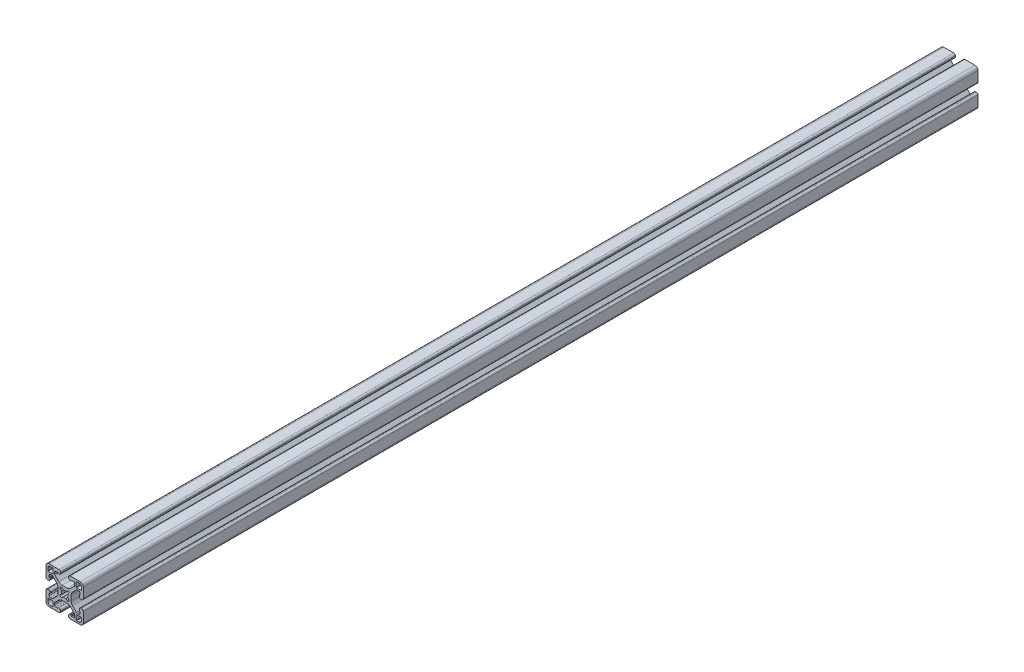
from build123d import *

# Parameters (mm, degrees)
EXTRUDE1_DEPTH = 914.4


with BuildPart() as part:
    # Sketch1 → Extrude1 (new body)
    with BuildSketch(Plane.XY):
        with BuildLine():
            Line((-46.536752228, -7.000622168), (-46.536752228, -8.774580164))
            ThreePointArc((-46.536752228, -8.774580164), (-46.907290083, -9.675221514), (-47.806745776, -10.048628264))
            Line((-47.806745776, -10.048628264), (-49.392633083, -10.048628264))
            ThreePointArc((-49.392633083, -10.048628264), (-49.878641042, -9.95195527), (-50.290658695, -9.676653876))
            Line((-50.290658695, -9.676653876), (-54.238761565, -5.728551005))
            ThreePointArc((-54.238761565, -5.728551005), (-55.26838878, -4.187604983), (-55.629945776, -2.369935216))
            Line((-55.629945776, -2.369935216), (-55.629945776, 2.846678689))
            ThreePointArc((-55.629945776, 2.846678689), (-55.26838878, 4.664348456), (-54.238761565, 6.205294478))
            Line((-54.238761565, 6.205294478), (-50.290658695, 10.153397348))
            ThreePointArc((-50.290658695, 10.153397348), (-49.878641042, 10.428698742), (-49.392633083, 10.525371736))
            Line((-49.392633083, 10.525371736), (-47.806745776, 10.525371736))
            ThreePointArc((-47.806745776, 10.525371736), (-46.907290079, 10.151964982), (-46.536752228, 9.251323623))
            Line((-46.536752228, 9.251323623), (-46.536752228, 7.47736564))
            ThreePointArc((-46.536752228, 7.47736564), (-46.648344767, 7.207957418), (-46.91775299, 7.096364878))
            Line((-46.91775299, 7.096364878), (-46.993953142, 7.096364878))
            ThreePointArc((-46.993953142, 7.096364878), (-47.263362671, 6.984771032), (-47.374953904, 6.715360422))
            Line((-47.374953904, 6.715360422), (-47.374945776, 5.877156465))
            ThreePointArc((-47.374945776, 5.877156465), (-46.913692136, 4.763614578), (-45.800145776, 4.302371736))
            Line((-45.800145776, 4.302371736), (-44.885745776, 4.302371736))
            ThreePointArc((-44.885745776, 4.302371736), (-43.772194017, 4.763619977), (-43.310945776, 5.877171736))
            Line((-43.310945776, 5.877171736), (-43.310945776, 16.113371736))
            ThreePointArc((-43.310945776, 16.113371736), (-44.240881746, 18.358435766), (-46.485945776, 19.288371736))
            Line((-46.485945776, 19.288371736), (-56.722145776, 19.288371736))
            ThreePointArc((-56.722145776, 19.288371736), (-57.835697535, 18.827123495), (-58.296945776, 17.713571736))
            Line((-58.296945776, 17.713571736), (-58.296945776, 16.799171736))
            ThreePointArc((-58.296945776, 16.799171736), (-57.835702934, 15.685625376), (-56.722161047, 15.224371736))
            Line((-56.722161047, 15.224371736), (-55.883957091, 15.224363608))
            ThreePointArc((-55.883957091, 15.224363608), (-55.61454648, 15.335954841), (-55.502952634, 15.60536437))
            Line((-55.502952634, 15.60536437), (-55.502952634, 15.681564523))
            ThreePointArc((-55.502952634, 15.681564523), (-55.391360095, 15.950972745), (-55.121951872, 16.062565285))
            Line((-55.121951872, 16.062565285), (-53.347993876, 16.062565285))
            ThreePointArc((-53.347993876, 16.062565285), (-52.447352526, 15.692027429), (-52.073945776, 14.792571736))
            Line((-52.073945776, 14.792571736), (-52.073945776, 13.206684429))
            ThreePointArc((-52.073945776, 13.206684429), (-52.17061877, 12.72067647), (-52.445920164, 12.308658817))
            Line((-52.445920164, 12.308658817), (-56.394023034, 8.360555947))
            ThreePointArc((-56.394023034, 8.360555947), (-57.934969057, 7.330928733), (-59.752638824, 6.969371736))
            Line((-59.752638824, 6.969371736), (-64.969252728, 6.969371736))
            ThreePointArc((-64.969252728, 6.969371736), (-66.786922495, 7.330928733), (-68.327868518, 8.360555947))
            Line((-68.327868518, 8.360555947), (-72.275971388, 12.308658817))
            ThreePointArc((-72.275971388, 12.308658817), (-72.551272782, 12.72067647), (-72.647945776, 13.206684429))
            Line((-72.647945776, 13.206684429), (-72.647945776, 14.792571736))
            ThreePointArc((-72.647945776, 14.792571736), (-72.274539022, 15.692027434), (-71.373897663, 16.062565285))
            Line((-71.373897663, 16.062565285), (-69.59993968, 16.062565285))
            ThreePointArc((-69.59993968, 16.062565285), (-69.330531458, 15.950972745), (-69.218938918, 15.681564523))
            Line((-69.218938918, 15.681564523), (-69.218938918, 15.60536437))
            ThreePointArc((-69.218938918, 15.60536437), (-69.107345072, 15.335954841), (-68.837934461, 15.224363608))
            Line((-68.837934461, 15.224363608), (-67.999730505, 15.224371736))
            ThreePointArc((-67.999730505, 15.224371736), (-66.886188618, 15.685625376), (-66.424945776, 16.799171736))
            Line((-66.424945776, 16.799171736), (-66.424945776, 17.713571736))
            ThreePointArc((-66.424945776, 17.713571736), (-66.886194017, 18.827123495), (-67.999745776, 19.288371736))
            Line((-67.999745776, 19.288371736), (-78.235945776, 19.288371736))
            ThreePointArc((-78.235945776, 19.288371736), (-80.481009806, 18.358435766), (-81.410945776, 16.113371736))
            Line((-81.410945776, 16.113371736), (-81.410945776, 5.877171736))
            ThreePointArc((-81.410945776, 5.877171736), (-80.949697535, 4.763619977), (-79.836145776, 4.302371736))
            Line((-79.836145776, 4.302371736), (-78.921745776, 4.302371736))
            ThreePointArc((-78.921745776, 4.302371736), (-77.808199416, 4.763614578), (-77.346945776, 5.877156465))
            Line((-77.346945776, 5.877156465), (-77.346937648, 6.715360422))
            ThreePointArc((-77.346937648, 6.715360422), (-77.458528881, 6.984771032), (-77.72793841, 7.096364878))
            Line((-77.72793841, 7.096364878), (-77.804138562, 7.096364878))
            ThreePointArc((-77.804138562, 7.096364878), (-78.073546785, 7.207957418), (-78.185139324, 7.47736564))
            Line((-78.185139324, 7.47736564), (-78.185139324, 9.251323637))
            ThreePointArc((-78.185139324, 9.251323637), (-77.814601469, 10.151964987), (-76.915145776, 10.525371736))
            Line((-76.915145776, 10.525371736), (-75.329258469, 10.525371736))
            ThreePointArc((-75.329258469, 10.525371736), (-74.84325051, 10.428698742), (-74.431232857, 10.153397348))
            Line((-74.431232857, 10.153397348), (-70.483129987, 6.205294478))
            ThreePointArc((-70.483129987, 6.205294478), (-69.453502773, 4.664348456), (-69.091945776, 2.846678689))
            Line((-69.091945776, 2.846678689), (-69.091945776, -2.369935216))
            ThreePointArc((-69.091945776, -2.369935216), (-69.453502773, -4.187604983), (-70.483129987, -5.728551005))
            Line((-70.483129987, -5.728551005), (-74.431232857, -9.676653876))
            ThreePointArc((-74.431232857, -9.676653876), (-74.84325051, -9.95195527), (-75.329258469, -10.048628264))
            Line((-75.329258469, -10.048628264), (-76.915145776, -10.048628264))
            ThreePointArc((-76.915145776, -10.048628264), (-77.814601473, -9.67522151), (-78.185139324, -8.774580151))
            Line((-78.185139324, -8.774580151), (-78.185139324, -7.000622168))
            ThreePointArc((-78.185139324, -7.000622168), (-78.073546785, -6.731213945), (-77.804138562, -6.619621406))
            Line((-77.804138562, -6.619621406), (-77.72793841, -6.619621406))
            ThreePointArc((-77.72793841, -6.619621406), (-77.458528881, -6.50802756), (-77.346937648, -6.238616949))
            Line((-77.346937648, -6.238616949), (-77.346945776, -5.400412993))
            ThreePointArc((-77.346945776, -5.400412993), (-77.808199416, -4.286871106), (-78.921745776, -3.825628264))
            Line((-78.921745776, -3.825628264), (-79.836145776, -3.825628264))
            ThreePointArc((-79.836145776, -3.825628264), (-80.949697535, -4.286876505), (-81.410945776, -5.400428264))
            Line((-81.410945776, -5.400428264), (-81.410945776, -15.636628264))
            ThreePointArc((-81.410945776, -15.636628264), (-80.481009806, -17.881692294), (-78.235945776, -18.811628264))
            Line((-78.235945776, -18.811628264), (-67.999745776, -18.811628264))
            ThreePointArc((-67.999745776, -18.811628264), (-66.886194017, -18.350380023), (-66.424945776, -17.236828264))
            Line((-66.424945776, -17.236828264), (-66.424945776, -16.322428264))
            ThreePointArc((-66.424945776, -16.322428264), (-66.886188618, -15.208881904), (-67.999730505, -14.747628264))
            Line((-67.999730505, -14.747628264), (-68.837934461, -14.747620136))
            ThreePointArc((-68.837934461, -14.747620136), (-69.107345072, -14.859211369), (-69.218938918, -15.128620898))
            Line((-69.218938918, -15.128620898), (-69.218938918, -15.20482105))
            ThreePointArc((-69.218938918, -15.20482105), (-69.330531458, -15.474229273), (-69.59993968, -15.585821812))
            Line((-69.59993968, -15.585821812), (-71.373897676, -15.585821812))
            ThreePointArc((-71.373897676, -15.585821812), (-72.274539027, -15.215283957), (-72.647945776, -14.315828264))
            Line((-72.647945776, -14.315828264), (-72.647945776, -12.729940957))
            ThreePointArc((-72.647945776, -12.729940957), (-72.551272782, -12.243932998), (-72.275971388, -11.831915345))
            Line((-72.275971388, -11.831915345), (-68.327868518, -7.883812475))
            ThreePointArc((-68.327868518, -7.883812475), (-66.786922495, -6.85418526), (-64.969252728, -6.492628264))
            Line((-64.969252728, -6.492628264), (-59.752638824, -6.492628264))
            ThreePointArc((-59.752638824, -6.492628264), (-57.934969057, -6.85418526), (-56.394023034, -7.883812475))
            Line((-56.394023034, -7.883812475), (-52.445920164, -11.831915345))
            ThreePointArc((-52.445920164, -11.831915345), (-52.17061877, -12.243932998), (-52.073945776, -12.729940957))
            Line((-52.073945776, -12.729940957), (-52.073945776, -14.315828264))
            ThreePointArc((-52.073945776, -14.315828264), (-52.44735253, -15.215283961), (-53.347993889, -15.585821812))
            Line((-53.347993889, -15.585821812), (-55.121951872, -15.585821812))
            ThreePointArc((-55.121951872, -15.585821812), (-55.391360095, -15.474229273), (-55.502952634, -15.20482105))
            Line((-55.502952634, -15.20482105), (-55.502952634, -15.128620898))
            ThreePointArc((-55.502952634, -15.128620898), (-55.61454648, -14.859211369), (-55.883957091, -14.747620136))
            Line((-55.883957091, -14.747620136), (-56.722161047, -14.747628264))
            ThreePointArc((-56.722161047, -14.747628264), (-57.835702934, -15.208881904), (-58.296945776, -16.322428264))
            Line((-58.296945776, -16.322428264), (-58.296945776, -17.236828264))
            ThreePointArc((-58.296945776, -17.236828264), (-57.835697535, -18.350380023), (-56.722145776, -18.811628264))
            Line((-56.722145776, -18.811628264), (-46.485945776, -18.811628264))
            ThreePointArc((-46.485945776, -18.811628264), (-44.240881746, -17.881692294), (-43.310945776, -15.636628264))
            Line((-43.310945776, -15.636628264), (-43.310945776, -5.400428264))
            ThreePointArc((-43.310945776, -5.400428264), (-43.772194017, -4.286876505), (-44.885745776, -3.825628264))
            Line((-44.885745776, -3.825628264), (-45.800145776, -3.825628264))
            ThreePointArc((-45.800145776, -3.825628264), (-46.913692136, -4.286871106), (-47.374945776, -5.400412993))
            Line((-47.374945776, -5.400412993), (-47.374953904, -6.238616949))
            ThreePointArc((-47.374953904, -6.238616949), (-47.263362671, -6.50802756), (-46.993953142, -6.619621406))
            Line((-46.993953142, -6.619621406), (-46.91775299, -6.619621406))
            ThreePointArc((-46.91775299, -6.619621406), (-46.648344767, -6.731213945), (-46.536752228, -7.000622168))
        make_face()
        with BuildLine():
            Line((-66.704246649, -2.488483035), (-65.333825803, -1.118062189))
            ThreePointArc((-65.333825803, -1.118062189), (-65.628655776, 0.238371736), (-65.333825803, 1.594805661))
            Line((-65.333825803, 1.594805661), (-66.704246649, 2.965226507))
            ThreePointArc((-66.704246649, 2.965226507), (-66.704246649, 4.581672609), (-65.087800547, 4.581672609))
            Line((-65.087800547, 4.581672609), (-63.717379701, 3.211251763))
            ThreePointArc((-63.717379701, 3.211251763), (-62.360945776, 3.506081736), (-61.004511851, 3.211251763))
            Line((-61.004511851, 3.211251763), (-59.721184579, 4.483982556))
            ThreePointArc((-59.721184579, 4.483982556), (-58.017644903, 4.581672609), (-58.115334956, 2.878132934))
            Line((-58.115334956, 2.878132934), (-59.38806575, 1.594805661))
            ThreePointArc((-59.38806575, 1.594805661), (-59.093235776, 0.238371736), (-59.38806575, -1.118062189))
            Line((-59.38806575, -1.118062189), (-58.017644903, -2.488483035))
            ThreePointArc((-58.017644903, -2.488483035), (-58.017644903, -4.104929137), (-59.634091005, -4.104929137))
            Line((-59.634091005, -4.104929137), (-61.004511851, -2.73450829))
            ThreePointArc((-61.004511851, -2.73450829), (-62.360945776, -3.029338264), (-63.717379701, -2.73450829))
            Line((-63.717379701, -2.73450829), (-65.087800547, -4.104929137))
            ThreePointArc((-65.087800547, -4.104929137), (-66.704246649, -4.104929137), (-66.704246649, -2.488483035))
        make_face(mode=Mode.SUBTRACT)
        with BuildLine():
            Line((-79.607545776, 12.481171736), (-79.607545776, 14.690971736))
            ThreePointArc((-79.607545776, 14.690971736), (-78.789202123, 16.666628083), (-76.813545776, 17.484971736))
            Line((-76.813545776, 17.484971736), (-74.603745776, 17.484971736))
            ThreePointArc((-74.603745776, 17.484971736), (-74.334338092, 17.37337942), (-74.222745776, 17.103971736))
            Line((-74.222745776, 17.103971736), (-74.222745776, 12.481171736))
            ThreePointArc((-74.222745776, 12.481171736), (-74.334338092, 12.211764053), (-74.603745776, 12.100171736))
            Line((-74.603745776, 12.100171736), (-79.226545776, 12.100171736))
            ThreePointArc((-79.226545776, 12.100171736), (-79.49595346, 12.211764053), (-79.607545776, 12.481171736))
        make_face(mode=Mode.SUBTRACT)
        with BuildLine():
            Line((-74.603745776, -17.008228264), (-76.813545776, -17.008228264))
            ThreePointArc((-76.813545776, -17.008228264), (-78.789202123, -16.18988461), (-79.607545776, -14.214228264))
            Line((-79.607545776, -14.214228264), (-79.607545776, -12.004428264))
            ThreePointArc((-79.607545776, -12.004428264), (-79.49595346, -11.73502058), (-79.226545776, -11.623428264))
            Line((-79.226545776, -11.623428264), (-74.603745776, -11.623428264))
            ThreePointArc((-74.603745776, -11.623428264), (-74.334338092, -11.73502058), (-74.222745776, -12.004428264))
            Line((-74.222745776, -12.004428264), (-74.222745776, -16.627228264))
            ThreePointArc((-74.222745776, -16.627228264), (-74.334338092, -16.896635947), (-74.603745776, -17.008228264))
        make_face(mode=Mode.SUBTRACT)
        with BuildLine():
            Line((-45.114345776, -12.004428264), (-45.114345776, -14.214228264))
            ThreePointArc((-45.114345776, -14.214228264), (-45.932689429, -16.18988461), (-47.908345776, -17.008228264))
            Line((-47.908345776, -17.008228264), (-50.118145776, -17.008228264))
            ThreePointArc((-50.118145776, -17.008228264), (-50.38755346, -16.896635947), (-50.499145776, -16.627228264))
            Line((-50.499145776, -16.627228264), (-50.499145776, -12.004428264))
            ThreePointArc((-50.499145776, -12.004428264), (-50.38755346, -11.73502058), (-50.118145776, -11.623428264))
            Line((-50.118145776, -11.623428264), (-45.495345776, -11.623428264))
            ThreePointArc((-45.495345776, -11.623428264), (-45.225938092, -11.73502058), (-45.114345776, -12.004428264))
        make_face(mode=Mode.SUBTRACT)
        with BuildLine():
            Line((-50.118145776, 17.484971736), (-47.908345776, 17.484971736))
            ThreePointArc((-47.908345776, 17.484971736), (-45.932689429, 16.666628083), (-45.114345776, 14.690971736))
            Line((-45.114345776, 14.690971736), (-45.114345776, 12.481171736))
            ThreePointArc((-45.114345776, 12.481171736), (-45.225938092, 12.211764053), (-45.495345776, 12.100171736))
            Line((-45.495345776, 12.100171736), (-50.118145776, 12.100171736))
            ThreePointArc((-50.118145776, 12.100171736), (-50.38755346, 12.211764053), (-50.499145776, 12.481171736))
            Line((-50.499145776, 12.481171736), (-50.499145776, 17.103971736))
            ThreePointArc((-50.499145776, 17.103971736), (-50.38755346, 17.37337942), (-50.118145776, 17.484971736))
        make_face(mode=Mode.SUBTRACT)
    extrude(amount=-EXTRUDE1_DEPTH)


solid = part.part
